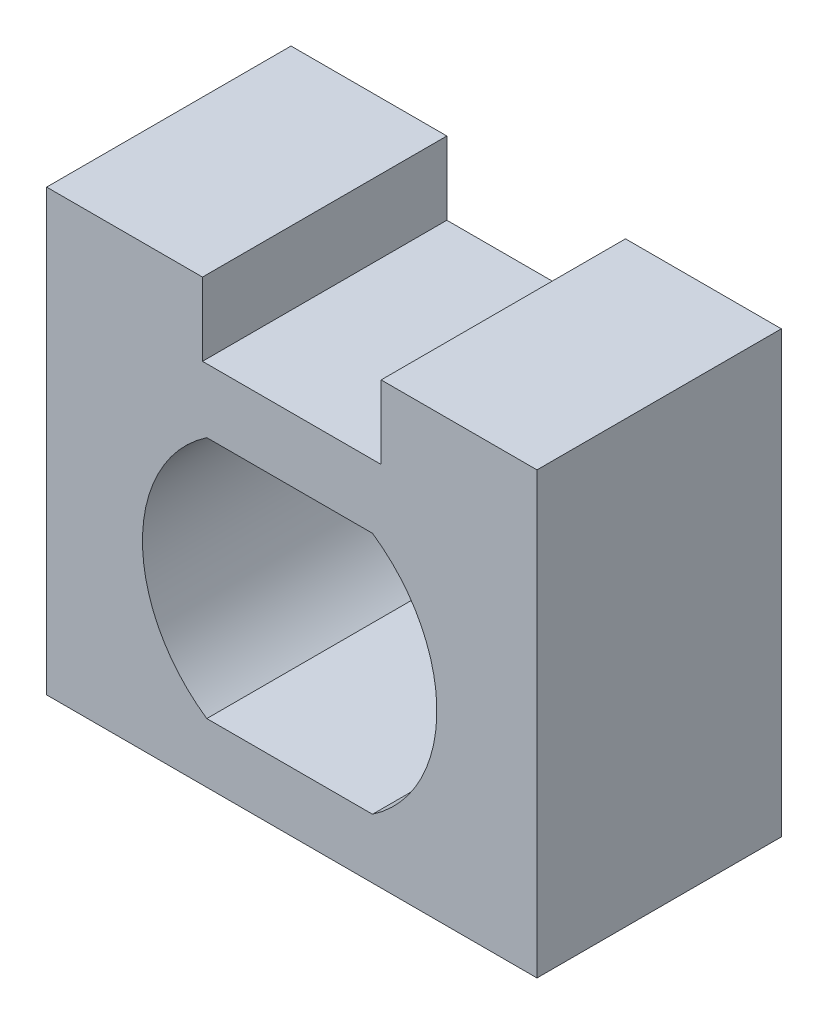
from build123d import *

# Parameters (mm, degrees)
BOSS_EXTRUDE1_DEPTH = 10


with BuildPart() as part:
    # Sketch1 → Boss-Extrude1 (new body)
    with BuildSketch(Plane.XY):
        Polygon((0, 15.0114), (0, 0), (20.066, 0), (20.066, 15.0114), (20.066, 18.0086), (13.6884, 18.0086), (13.6884, 15.0114), (6.3776, 15.0114), (6.3776, 17.998004192), (0, 17.998004192), align=None)
        with BuildLine():
            Line((6.5532, 12.3952), (9.9441, 12.3952))
            Line((9.9441, 12.3952), (13.335, 12.3952))
            ThreePointArc((13.335, 12.3952), (15.967609722, 7.4168), (13.335, 2.4384))
            Line((13.335, 2.4384), (9.9441, 2.4384))
            Line((9.9441, 2.4384), (6.5532, 2.4384))
            ThreePointArc((6.5532, 2.4384), (3.920590278, 7.4168), (6.5532, 12.3952))
        make_face(mode=Mode.SUBTRACT)
    extrude(amount=BOSS_EXTRUDE1_DEPTH)


solid = part.part
